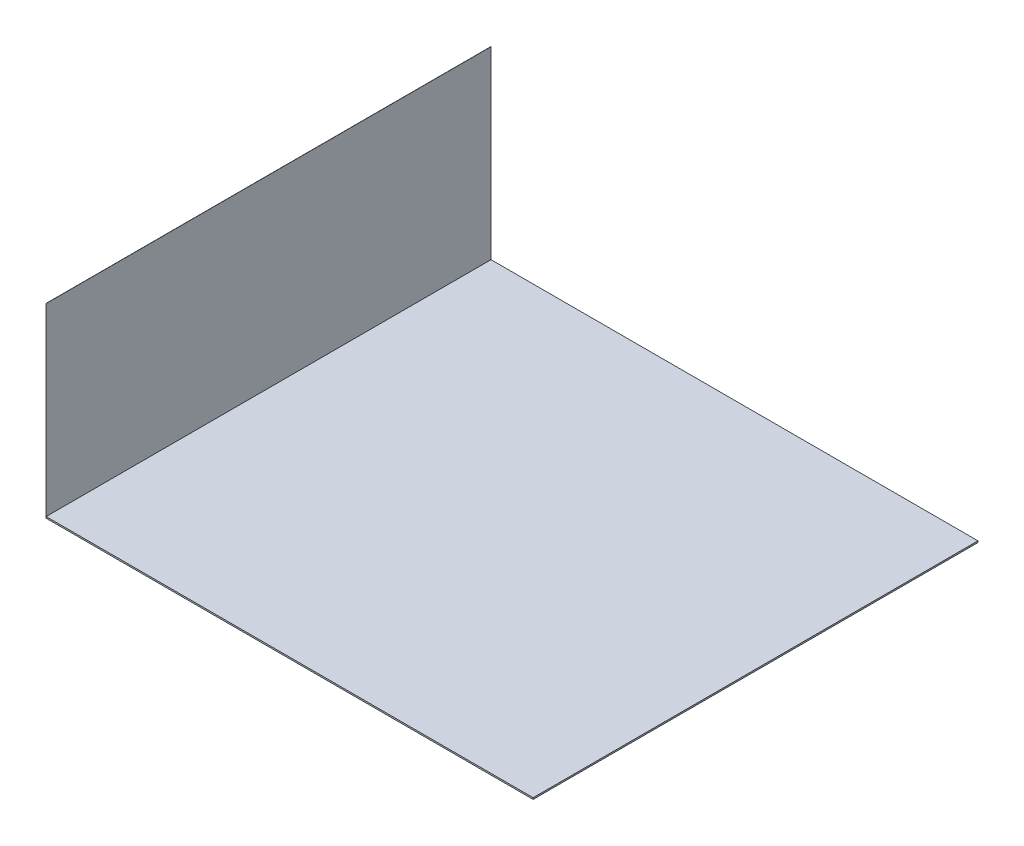
from build123d import *

# Parameters (mm, degrees)
EXTRUDE3_DEPTH = 8229.6
SKETCH6_W      = 7518.4
SKETCH6_H      = 3117.85
EXTRUDE5_DEPTH = 2.54


with BuildPart() as part:
    # Sketch4 → Extrude3 (new body)
    with BuildSketch(Plane(origin=(0, 0, 0), x_dir=(0, 0, -1), z_dir=(1, 0, 0))):
        Polygon((0, 0), (838.2, 0), (6680.2, 0), (7518.4, 0), (7518.4, -25.4), (0, -25.4), align=None)
    extrude(amount=EXTRUDE3_DEPTH)


with BuildPart() as body_2:
    # Sketch6 → Extrude5 (new body)
    with BuildSketch(Plane(origin=(0, 0, 0), x_dir=(0, 0, -1), z_dir=(1, 0, 0))):
        with Locations((3759.2, 1558.925)):
            Rectangle(SKETCH6_W, SKETCH6_H)
    extrude(amount=-EXTRUDE5_DEPTH)


solid = Compound([part.part, body_2.part])
